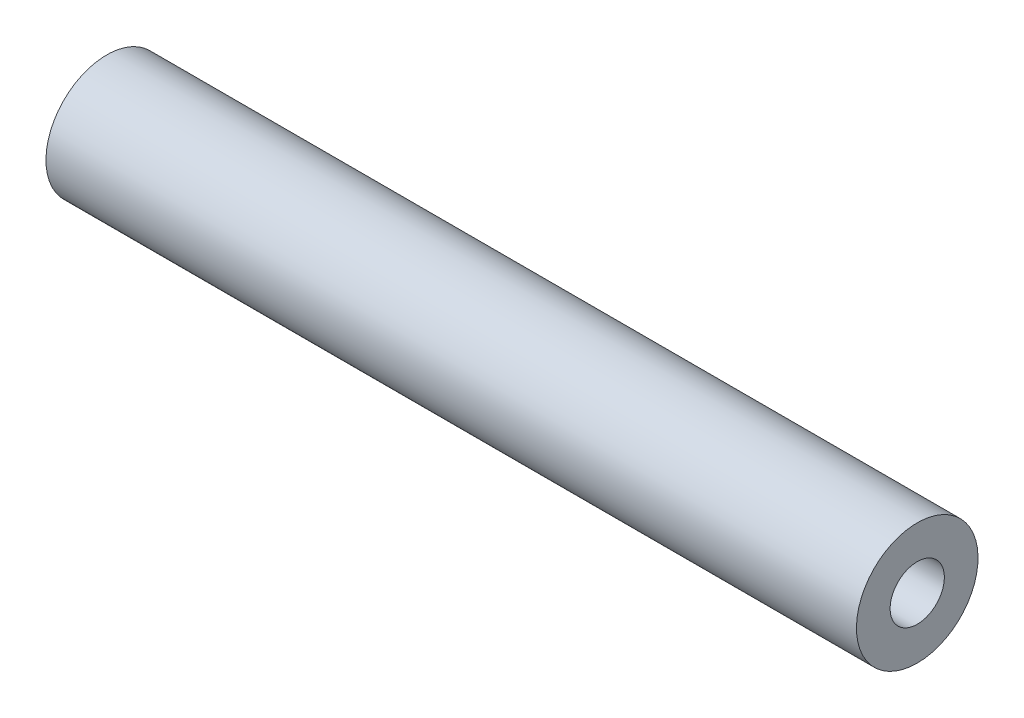
from build123d import *


with BuildPart() as part:
    # Sketch1 → Revolve1 (revolve)
    with BuildSketch(Plane.XY):
        Polygon((0, 0), (0, 3.81), (50.8, 3.81), (50.8, 0), (37.892541774, 0), (12.907458226, 0), align=None)
    revolve(axis=Axis((0, 3.81, 0), (1, 0, 0)))

    # Sketch6 → M3 Clearance Hole1 (revolve, cut)
    with BuildSketch(Plane.ZX.offset(3.81)):
        Polygon((0, 0), (0, 7.371463052), (1.7, 6.35), (1.7, 0), align=None)
    m3_clearance_hole1 = revolve(axis=Axis((-6.35, 3.81, 0), (1, 0, 0)), mode=Mode.SUBTRACT)

    # Mirror1: M3 Clearance Hole1 across plane
    add(m3_clearance_hole1.mirror(Plane.ZY.offset(-25.4)), mode=Mode.SUBTRACT)


solid = part.part
